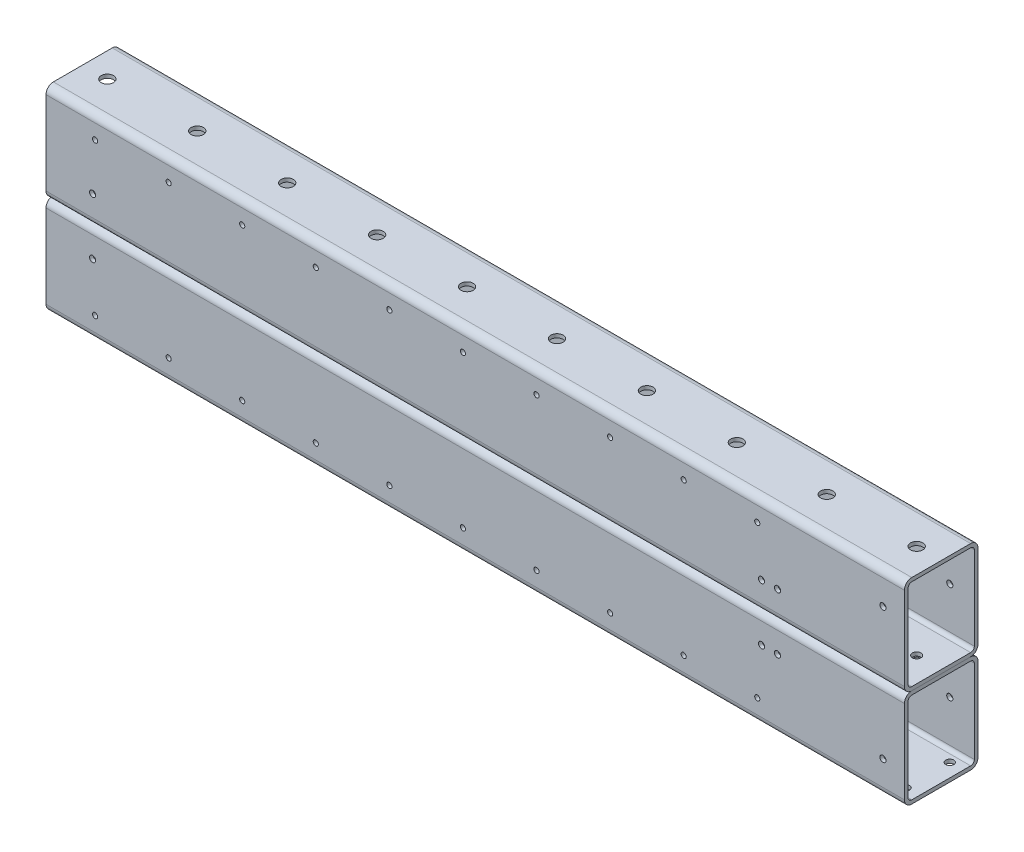
from build123d import *

# Parameters (mm, degrees)
BOSS_EXTRUDE1_DEPTH                   = 350
BOSS_EXTRUDE1_DEPTH_BACK              = 350
BOSS_EXTRUDE2_DEPTH                   = 350
BOSS_EXTRUDE2_DEPTH_BACK              = 350
SKETCH2_R                             = 5
CUT_EXTRUDE1_DEPTH                    = 3
SKETCH3_R                             = 3.5
CUT_EXTRUDE2_DEPTH                    = 3
TAP_DRILL_FOR_M6X1_0_TAP1_AT_2_COUNT  = 2
TAP_DRILL_FOR_M6X1_0_TAP1_AT_2_PITCH  = 73.33
TAP_DRILL_FOR_M6X1_0_TAP1_AT_3_COUNT  = 2
TAP_DRILL_FOR_M6X1_0_TAP1_AT_3_PITCH  = 146.66
TAP_DRILL_FOR_M6X1_0_TAP1_AT_4_COUNT  = 2
TAP_DRILL_FOR_M6X1_0_TAP1_AT_4_PITCH  = 219.99
TAP_DRILL_FOR_M6X1_0_TAP1_AT_5_COUNT  = 2
TAP_DRILL_FOR_M6X1_0_TAP1_AT_5_PITCH  = 293.32
TAP_DRILL_FOR_M6X1_0_TAP1_AT_6_COUNT  = 2
TAP_DRILL_FOR_M6X1_0_TAP1_AT_6_PITCH  = 366.65
TAP_DRILL_FOR_M6X1_0_TAP1_AT_7_COUNT  = 2
TAP_DRILL_FOR_M6X1_0_TAP1_AT_7_PITCH  = 439.98
TAP_DRILL_FOR_M6X1_0_TAP1_AT_8_COUNT  = 2
TAP_DRILL_FOR_M6X1_0_TAP1_AT_8_PITCH  = 513.31
TAP_DRILL_FOR_M6X1_0_TAP1_AT_9_COUNT  = 2
TAP_DRILL_FOR_M6X1_0_TAP1_AT_9_PITCH  = 586.64
TAP_DRILL_FOR_M6X1_0_TAP1_AT_10_COUNT = 2
TAP_DRILL_FOR_M6X1_0_TAP1_AT_10_PITCH = 659.97
TAP_DRILL_FOR_M6X1_0_TAP2_AT_2_COUNT  = 2
TAP_DRILL_FOR_M6X1_0_TAP2_AT_2_PITCH  = 40
TAP_DRILL_FOR_M6X1_0_TAP2_AT_3_COUNT  = 2
TAP_DRILL_FOR_M6X1_0_TAP2_AT_3_PITCH  = 80
TAP_DRILL_FOR_M6X1_0_TAP2_AT_4_COUNT  = 2
TAP_DRILL_FOR_M6X1_0_TAP2_AT_4_PITCH  = 89.4427191
TAP_DRILL_FOR_M5X0_8_TAP1_AT_2_COUNT  = 2
TAP_DRILL_FOR_M5X0_8_TAP1_AT_2_PITCH  = 123.96353247
LPATTERN1_COUNT                       = 10
LPATTERN1_PITCH                       = 60
TAP_DRILL_FOR_M6X1_0_TAP4_AT_2_COUNT  = 2
TAP_DRILL_FOR_M6X1_0_TAP4_AT_2_PITCH  = 107.6
F_6_5_6_5_DIAMETER_HOLE1_AT_2_COUNT   = 2
F_6_5_6_5_DIAMETER_HOLE1_AT_2_PITCH   = 36
F_6_5_6_5_DIAMETER_HOLE1_AT_3_COUNT   = 2
F_6_5_6_5_DIAMETER_HOLE1_AT_3_PITCH   = 68.264192664
F_6_5_6_5_DIAMETER_HOLE1_AT_4_COUNT   = 2
F_6_5_6_5_DIAMETER_HOLE1_AT_4_PITCH   = 58
F_6_5_6_5_DIAMETER_HOLE1_AT_5_COUNT   = 2
F_6_5_6_5_DIAMETER_HOLE1_AT_5_PITCH   = 562
F_6_5_6_5_DIAMETER_HOLE1_AT_6_COUNT   = 2
F_6_5_6_5_DIAMETER_HOLE1_AT_6_PITCH   = 563.151844532
F_6_5_6_5_DIAMETER_HOLE1_AT_7_COUNT   = 2
F_6_5_6_5_DIAMETER_HOLE1_AT_7_PITCH   = 621.044281835
F_6_5_6_5_DIAMETER_HOLE1_AT_8_COUNT   = 2
F_6_5_6_5_DIAMETER_HOLE1_AT_8_PITCH   = 620
TAP_DRILL_FOR_M6X1_0_TAP5_AT_2_COUNT  = 2
TAP_DRILL_FOR_M6X1_0_TAP5_AT_2_PITCH  = 46
TAP_DRILL_FOR_M6X1_0_TAP5_AT_3_COUNT  = 2
TAP_DRILL_FOR_M6X1_0_TAP5_AT_3_PITCH  = 545.5
TAP_DRILL_FOR_M6X1_0_TAP5_AT_4_COUNT  = 2
TAP_DRILL_FOR_M6X1_0_TAP5_AT_4_PITCH  = 558.5
TAP_DRILL_FOR_M6X1_0_TAP5_AT_5_COUNT  = 2
TAP_DRILL_FOR_M6X1_0_TAP5_AT_5_PITCH  = 560.391158032
TAP_DRILL_FOR_M6X1_0_TAP5_AT_6_COUNT  = 2
TAP_DRILL_FOR_M6X1_0_TAP5_AT_6_PITCH  = 547.436069327


with BuildPart() as part:
    # Sketch1 → Boss-Extrude1 (new, two sides: drawn at the far end of the back side and taken through both)
    with BuildSketch(Plane(origin=(0, 0, 0), x_dir=(0, 0, -1), z_dir=(1, 0, 0)).offset(-BOSS_EXTRUDE1_DEPTH_BACK)):
        with BuildLine():
            Line((-24, 0), (24, 0))
            ThreePointArc((24, 0), (28.242640687, 1.757359313), (30, 6))
            Line((30, 6), (30, 74))
            ThreePointArc((30, 74), (28.242640687, 78.242640687), (24, 80))
            Line((24, 80), (-24, 80))
            ThreePointArc((-24, 80), (-28.242640687, 78.242640687), (-30, 74))
            Line((-30, 74), (-30, 6))
            ThreePointArc((-30, 6), (-28.242640687, 1.757359313), (-24, 0))
        make_face()
        with BuildLine():
            Line((-24, 3), (24, 3))
            ThreePointArc((24, 3), (26.121320344, 3.878679656), (27, 6))
            Line((27, 6), (27, 74))
            ThreePointArc((27, 74), (26.121320344, 76.121320344), (24, 77))
            Line((24, 77), (-24, 77))
            ThreePointArc((-24, 77), (-26.121320344, 76.121320344), (-27, 74))
            Line((-27, 74), (-27, 6))
            ThreePointArc((-27, 6), (-26.121320344, 3.878679656), (-24, 3))
        make_face(mode=Mode.SUBTRACT)
    extrude(amount=BOSS_EXTRUDE1_DEPTH + BOSS_EXTRUDE1_DEPTH_BACK)

    # Sketch2 → Cut-Extrude1 (cut)
    with BuildSketch(Plane(origin=(0, 80, 0), x_dir=(1, 0, 0), z_dir=(0, 1, 0))):
        with Locations(Location((330, 0, 0), (0, 0, 270))):
            Circle(SKETCH2_R)
        with Locations(Location((256.67, 0, 0), (0, 0, 270))):
            Circle(SKETCH2_R)
        with Locations(Location((183.34, 0, 0), (0, 0, 270))):
            Circle(SKETCH2_R)
        with Locations(Location((110.01, 0, 0), (0, 0, 270))):
            Circle(SKETCH2_R)
        with Locations(Location((36.68, 0, 0), (0, 0, 270))):
            Circle(SKETCH2_R)
        with Locations(Location((-36.65, 0, 0), (0, 0, 270))):
            Circle(SKETCH2_R)
        with Locations(Location((-109.98, 0, 0), (0, 0, 270))):
            Circle(SKETCH2_R)
        with Locations(Location((-183.31, 0, 0), (0, 0, 270))):
            Circle(SKETCH2_R)
        with Locations(Location((-256.64, 0, 0), (0, 0, 270))):
            Circle(SKETCH2_R)
        with Locations(Location((-329.97, 0, 0), (0, 0, 270))):
            Circle(SKETCH2_R)
    extrude(amount=-CUT_EXTRUDE1_DEPTH, mode=Mode.SUBTRACT)

    # Sketch3 → Cut-Extrude2 (cut)
    with BuildSketch(Plane(origin=(0, 3, 0), x_dir=(1, 0, 0), z_dir=(0, 1, 0))):
        with Locations(Location((-329.97, 0, 0), (0, 0, 270))):
            Circle(SKETCH3_R)
        with Locations(Location((-256.64, 0, 0), (0, 0, 270))):
            Circle(SKETCH3_R)
        with Locations(Location((-183.31, 0, 0), (0, 0, 270))):
            Circle(SKETCH3_R)
        with Locations(Location((-109.98, 0, 0), (0, 0, 270))):
            Circle(SKETCH3_R)
        with Locations(Location((-36.65, 0, 0), (0, 0, 270))):
            Circle(SKETCH3_R)
        with Locations(Location((36.68, 0, 0), (0, 0, 270))):
            Circle(SKETCH3_R)
        with Locations(Location((110.01, 0, 0), (0, 0, 270))):
            Circle(SKETCH3_R)
        with Locations(Location((183.34, 0, 0), (0, 0, 270))):
            Circle(SKETCH3_R)
        with Locations(Location((256.67, 0, 0), (0, 0, 270))):
            Circle(SKETCH3_R)
        with Locations(Location((330, 0, 0), (0, 0, 270))):
            Circle(SKETCH3_R)
    extrude(amount=-CUT_EXTRUDE2_DEPTH, mode=Mode.SUBTRACT)

    # Sketch6 → Tap Drill for M6x1.0 Tap2 (revolve, cut)
    with BuildSketch(Plane(origin=(330, 40, -30), x_dir=(0, 1, 0), z_dir=(1, 0, 0))):
        Polygon((0, 0), (0, 4.502151548), (2.5, 3), (2.5, 0), align=None)
    tap_drill_for_m6x1_0_tap2 = revolve(axis=Axis((330, 40, -36.35), (0, 0, 1)), mode=Mode.SUBTRACT)

    # Tap Drill for M6x1.0 Tap2 at 2: Tap Drill for M6x1.0 Tap2 ×2
    with Locations(*[(-i * TAP_DRILL_FOR_M6X1_0_TAP2_AT_2_PITCH, 0, 0) for i in range(1, TAP_DRILL_FOR_M6X1_0_TAP2_AT_2_COUNT)]):
        add(tap_drill_for_m6x1_0_tap2, mode=Mode.SUBTRACT)

    # Mirror1: Tap Drill for M6x1.0 Tap2 across plane
    add(tap_drill_for_m6x1_0_tap2.mirror(Plane(origin=(0, 0, 0), x_dir=(0, 0, 1), z_dir=(1, 0, 0))), mode=Mode.SUBTRACT)

    # Mirror1 copy 1 sketch → Mirror1 copy 1 (revolve, cut)
    with BuildSketch(Plane(origin=(-290, 40, -30), x_dir=(0, 1, 0), z_dir=(-1, 0, 0))):
        Polygon((0, 0), (0, -4.502151548), (2.5, -3), (2.5, 0), align=None)
    revolve(axis=Axis((-290, 40, -36.35), (0, 0, -1)), mode=Mode.SUBTRACT)

    # Sketch10 → Tap Drill for M5x0.8 Tap1 (revolve, cut)
    with BuildSketch(Plane(origin=(-310, 61.981766235, 30), x_dir=(0, -1, 0), z_dir=(1, 0, 0))):
        Polygon((0, 0), (0, 4.2618073), (2.1, 3), (2.1, 0), align=None)
    tap_drill_for_m5x0_8_tap1 = revolve(axis=Axis((-310, 61.981766235, 36.35), (0, 0, -1)), mode=Mode.SUBTRACT)

    # LPattern1: Tap Drill for M5x0.8 Tap1 ×10
    with Locations(*[(i * LPATTERN1_PITCH, 0, 0) for i in range(1, LPATTERN1_COUNT)]):
        add(tap_drill_for_m5x0_8_tap1, mode=Mode.SUBTRACT)


with BuildPart() as body_2:
    # Sketch1<3> → Boss-Extrude2 (new, two sides: drawn at the far end of the back side and taken through both)
    with BuildSketch(Plane(origin=(0, 0, 0), x_dir=(0, 0, -1), z_dir=(1, 0, 0)).offset(-BOSS_EXTRUDE2_DEPTH_BACK)):
        with BuildLine():
            ThreePointArc((-30, -6), (-28.242640687, -1.757359313), (-24, 0))
            Line((-24, 0), (24, 0))
            ThreePointArc((24, 0), (28.242640687, -1.757359313), (30, -6))
            Line((30, -6), (30, -74))
            ThreePointArc((30, -74), (28.242640687, -78.242640687), (24, -80))
            Line((24, -80), (-24, -80))
            ThreePointArc((-24, -80), (-28.242640687, -78.242640687), (-30, -74))
            Line((-30, -74), (-30, -6))
        make_face()
        with BuildLine():
            Line((-24, -77), (24, -77))
            ThreePointArc((24, -77), (26.121320344, -76.121320344), (27, -74))
            Line((27, -74), (27, -6))
            ThreePointArc((27, -6), (26.121320344, -3.878679656), (24, -3))
            Line((24, -3), (-24, -3))
            ThreePointArc((-24, -3), (-26.121320344, -3.878679656), (-27, -6))
            Line((-27, -6), (-27, -74))
            ThreePointArc((-27, -74), (-26.121320344, -76.121320344), (-24, -77))
        make_face(mode=Mode.SUBTRACT)
    extrude(amount=BOSS_EXTRUDE2_DEPTH + BOSS_EXTRUDE2_DEPTH_BACK)

    # Sketch4 → Tap Drill for M6x1.0 Tap1 (revolve, cut)
    with BuildSketch(Plane(origin=(-329.97, 3, 0), x_dir=(0, 0, 1), z_dir=(1, 0, 0))):
        Polygon((0, 0), (0, 7.502151548), (2.5, 6), (2.5, 0), align=None)
    tap_drill_for_m6x1_0_tap1 = revolve(axis=Axis((-329.97, 9.35, 0), (0, -1, 0)), mode=Mode.SUBTRACT)

    # Tap Drill for M6x1.0 Tap1 at 2: Tap Drill for M6x1.0 Tap1 ×2
    with Locations(*[(i * TAP_DRILL_FOR_M6X1_0_TAP1_AT_2_PITCH, 0, 0) for i in range(1, TAP_DRILL_FOR_M6X1_0_TAP1_AT_2_COUNT)]):
        add(tap_drill_for_m6x1_0_tap1, mode=Mode.SUBTRACT)

    # Tap Drill for M6x1.0 Tap1 at 3: Tap Drill for M6x1.0 Tap1 ×2
    with Locations(*[(i * TAP_DRILL_FOR_M6X1_0_TAP1_AT_3_PITCH, 0, 0) for i in range(1, TAP_DRILL_FOR_M6X1_0_TAP1_AT_3_COUNT)]):
        add(tap_drill_for_m6x1_0_tap1, mode=Mode.SUBTRACT)

    # Tap Drill for M6x1.0 Tap1 at 4: Tap Drill for M6x1.0 Tap1 ×2
    with Locations(*[(i * TAP_DRILL_FOR_M6X1_0_TAP1_AT_4_PITCH, 0, 0) for i in range(1, TAP_DRILL_FOR_M6X1_0_TAP1_AT_4_COUNT)]):
        add(tap_drill_for_m6x1_0_tap1, mode=Mode.SUBTRACT)

    # Tap Drill for M6x1.0 Tap1 at 5: Tap Drill for M6x1.0 Tap1 ×2
    with Locations(*[(i * TAP_DRILL_FOR_M6X1_0_TAP1_AT_5_PITCH, 0, 0) for i in range(1, TAP_DRILL_FOR_M6X1_0_TAP1_AT_5_COUNT)]):
        add(tap_drill_for_m6x1_0_tap1, mode=Mode.SUBTRACT)

    # Tap Drill for M6x1.0 Tap1 at 6: Tap Drill for M6x1.0 Tap1 ×2
    with Locations(*[(i * TAP_DRILL_FOR_M6X1_0_TAP1_AT_6_PITCH, 0, 0) for i in range(1, TAP_DRILL_FOR_M6X1_0_TAP1_AT_6_COUNT)]):
        add(tap_drill_for_m6x1_0_tap1, mode=Mode.SUBTRACT)

    # Tap Drill for M6x1.0 Tap1 at 7: Tap Drill for M6x1.0 Tap1 ×2
    with Locations(*[(i * TAP_DRILL_FOR_M6X1_0_TAP1_AT_7_PITCH, 0, 0) for i in range(1, TAP_DRILL_FOR_M6X1_0_TAP1_AT_7_COUNT)]):
        add(tap_drill_for_m6x1_0_tap1, mode=Mode.SUBTRACT)

    # Tap Drill for M6x1.0 Tap1 at 8: Tap Drill for M6x1.0 Tap1 ×2
    with Locations(*[(i * TAP_DRILL_FOR_M6X1_0_TAP1_AT_8_PITCH, 0, 0) for i in range(1, TAP_DRILL_FOR_M6X1_0_TAP1_AT_8_COUNT)]):
        add(tap_drill_for_m6x1_0_tap1, mode=Mode.SUBTRACT)

    # Tap Drill for M6x1.0 Tap1 at 9: Tap Drill for M6x1.0 Tap1 ×2
    with Locations(*[(i * TAP_DRILL_FOR_M6X1_0_TAP1_AT_9_PITCH, 0, 0) for i in range(1, TAP_DRILL_FOR_M6X1_0_TAP1_AT_9_COUNT)]):
        add(tap_drill_for_m6x1_0_tap1, mode=Mode.SUBTRACT)

    # Tap Drill for M6x1.0 Tap1 at 10: Tap Drill for M6x1.0 Tap1 ×2
    with Locations(*[(i * TAP_DRILL_FOR_M6X1_0_TAP1_AT_10_PITCH, 0, 0) for i in range(1, TAP_DRILL_FOR_M6X1_0_TAP1_AT_10_COUNT)]):
        add(tap_drill_for_m6x1_0_tap1, mode=Mode.SUBTRACT)

    # Tap Drill for M6x1.0 Tap2 at 3: Tap Drill for M6x1.0 Tap2 ×2
    with Locations(*[(0, -i * TAP_DRILL_FOR_M6X1_0_TAP2_AT_3_PITCH, 0) for i in range(1, TAP_DRILL_FOR_M6X1_0_TAP2_AT_3_COUNT)]):
        add(tap_drill_for_m6x1_0_tap2, mode=Mode.SUBTRACT)

    # Tap Drill for M6x1.0 Tap2 at 4: Tap Drill for M6x1.0 Tap2 ×2
    with Locations(*[Vector(-0.4472135954999575, -0.8944271909999161, 0) * (i * TAP_DRILL_FOR_M6X1_0_TAP2_AT_4_PITCH) for i in range(1, TAP_DRILL_FOR_M6X1_0_TAP2_AT_4_COUNT)]):
        add(tap_drill_for_m6x1_0_tap2, mode=Mode.SUBTRACT)

    # Mirror1 copy 2 sketch → Mirror1 copy 2 (revolve, cut)
    with BuildSketch(Plane(origin=(-330, -40, -30), x_dir=(0, 1, 0), z_dir=(-1, 0, 0))):
        Polygon((0, 0), (0, -4.502151548), (2.5, -3), (2.5, 0), align=None)
    revolve(axis=Axis((-330, -40, -36.35), (0, 0, -1)), mode=Mode.SUBTRACT)

    # Mirror1 copy 3 sketch → Mirror1 copy 3 (revolve, cut)
    with BuildSketch(Plane(origin=(-290, -40, -30), x_dir=(0, 1, 0), z_dir=(-1, 0, 0))):
        Polygon((0, 0), (0, -4.502151548), (2.5, -3), (2.5, 0), align=None)
    revolve(axis=Axis((-290, -40, -36.35), (0, 0, -1)), mode=Mode.SUBTRACT)

    # Tap Drill for M5x0.8 Tap1 at 2: Tap Drill for M5x0.8 Tap1 ×2
    with Locations(*[(0, -i * TAP_DRILL_FOR_M5X0_8_TAP1_AT_2_PITCH, 0) for i in range(1, TAP_DRILL_FOR_M5X0_8_TAP1_AT_2_COUNT)]):
        add(tap_drill_for_m5x0_8_tap1, mode=Mode.SUBTRACT)

    # LPattern1 copy 1 sketch → LPattern1 copy 1 (revolve, cut)
    with BuildSketch(Plane(origin=(-250, -61.981766235, 30), x_dir=(0, -1, 0), z_dir=(1, 0, 0))):
        Polygon((0, 0), (0, 4.2618073), (2.1, 3), (2.1, 0), align=None)
    revolve(axis=Axis((-250, -61.981766235, 36.35), (0, 0, -1)), mode=Mode.SUBTRACT)

    # LPattern1 copy 2 sketch → LPattern1 copy 2 (revolve, cut)
    with BuildSketch(Plane(origin=(-190, -61.981766235, 30), x_dir=(0, -1, 0), z_dir=(1, 0, 0))):
        Polygon((0, 0), (0, 4.2618073), (2.1, 3), (2.1, 0), align=None)
    revolve(axis=Axis((-190, -61.981766235, 36.35), (0, 0, -1)), mode=Mode.SUBTRACT)

    # LPattern1 copy 3 sketch → LPattern1 copy 3 (revolve, cut)
    with BuildSketch(Plane(origin=(-130, -61.981766235, 30), x_dir=(0, -1, 0), z_dir=(1, 0, 0))):
        Polygon((0, 0), (0, 4.2618073), (2.1, 3), (2.1, 0), align=None)
    revolve(axis=Axis((-130, -61.981766235, 36.35), (0, 0, -1)), mode=Mode.SUBTRACT)

    # LPattern1 copy 4 sketch → LPattern1 copy 4 (revolve, cut)
    with BuildSketch(Plane(origin=(-70, -61.981766235, 30), x_dir=(0, -1, 0), z_dir=(1, 0, 0))):
        Polygon((0, 0), (0, 4.2618073), (2.1, 3), (2.1, 0), align=None)
    revolve(axis=Axis((-70, -61.981766235, 36.35), (0, 0, -1)), mode=Mode.SUBTRACT)

    # LPattern1 copy 5 sketch → LPattern1 copy 5 (revolve, cut)
    with BuildSketch(Plane(origin=(-10, -61.981766235, 30), x_dir=(0, -1, 0), z_dir=(1, 0, 0))):
        Polygon((0, 0), (0, 4.2618073), (2.1, 3), (2.1, 0), align=None)
    revolve(axis=Axis((-10, -61.981766235, 36.35), (0, 0, -1)), mode=Mode.SUBTRACT)

    # LPattern1 copy 6 sketch → LPattern1 copy 6 (revolve, cut)
    with BuildSketch(Plane(origin=(50, -61.981766235, 30), x_dir=(0, -1, 0), z_dir=(1, 0, 0))):
        Polygon((0, 0), (0, 4.2618073), (2.1, 3), (2.1, 0), align=None)
    revolve(axis=Axis((50, -61.981766235, 36.35), (0, 0, -1)), mode=Mode.SUBTRACT)

    # LPattern1 copy 7 sketch → LPattern1 copy 7 (revolve, cut)
    with BuildSketch(Plane(origin=(110, -61.981766235, 30), x_dir=(0, -1, 0), z_dir=(1, 0, 0))):
        Polygon((0, 0), (0, 4.2618073), (2.1, 3), (2.1, 0), align=None)
    revolve(axis=Axis((110, -61.981766235, 36.35), (0, 0, -1)), mode=Mode.SUBTRACT)

    # LPattern1 copy 8 sketch → LPattern1 copy 8 (revolve, cut)
    with BuildSketch(Plane(origin=(170, -61.981766235, 30), x_dir=(0, -1, 0), z_dir=(1, 0, 0))):
        Polygon((0, 0), (0, 4.2618073), (2.1, 3), (2.1, 0), align=None)
    revolve(axis=Axis((170, -61.981766235, 36.35), (0, 0, -1)), mode=Mode.SUBTRACT)

    # LPattern1 copy 9 sketch → LPattern1 copy 9 (revolve, cut)
    with BuildSketch(Plane(origin=(230, -61.981766235, 30), x_dir=(0, -1, 0), z_dir=(1, 0, 0))):
        Polygon((0, 0), (0, 4.2618073), (2.1, 3), (2.1, 0), align=None)
    revolve(axis=Axis((230, -61.981766235, 36.35), (0, 0, -1)), mode=Mode.SUBTRACT)

    # Sketch13 → Tap Drill for M6x1.0 Tap4 (revolve, cut)
    with BuildSketch(Plane(origin=(332.5, -53.8, 30), x_dir=(0, -1, 0), z_dir=(1, 0, 0))):
        Polygon((0, 0), (0, 4.502151548), (2.5, 3), (2.5, 0), align=None)
    tap_drill_for_m6x1_0_tap4 = revolve(axis=Axis((332.5, -53.8, 36.35), (0, 0, -1)), mode=Mode.SUBTRACT)

    # Sketch15 → Ø6.5 (6.5) Diameter Hole1 (revolve, cut)
    with BuildSketch(Plane(origin=(-281, -80, 18), x_dir=(0, 0, -1), z_dir=(1, 0, 0))):
        Polygon((0, 0), (0, 4.952797012), (3.25, 3), (3.25, 0), align=None)
    f_6_5_6_5_diameter_hole1 = revolve(axis=Axis((-281, -86.35, 18), (0, 1, 0)), mode=Mode.SUBTRACT)

    # Ø6.5 (6.5) Diameter Hole1 at 2: Ø6.5 (6.5) Diameter Hole1 ×2
    with Locations(*[(0, 0, -i * F_6_5_6_5_DIAMETER_HOLE1_AT_2_PITCH) for i in range(1, F_6_5_6_5_DIAMETER_HOLE1_AT_2_COUNT)]):
        add(f_6_5_6_5_diameter_hole1, mode=Mode.SUBTRACT)

    # Ø6.5 (6.5) Diameter Hole1 at 3: Ø6.5 (6.5) Diameter Hole1 ×2
    with Locations(*[Vector(-0.8496401661981189, 0, -0.5273628617781433) * (i * F_6_5_6_5_DIAMETER_HOLE1_AT_3_PITCH) for i in range(1, F_6_5_6_5_DIAMETER_HOLE1_AT_3_COUNT)]):
        add(f_6_5_6_5_diameter_hole1, mode=Mode.SUBTRACT)

    # Ø6.5 (6.5) Diameter Hole1 at 4: Ø6.5 (6.5) Diameter Hole1 ×2
    with Locations(*[(-i * F_6_5_6_5_DIAMETER_HOLE1_AT_4_PITCH, 0, 0) for i in range(1, F_6_5_6_5_DIAMETER_HOLE1_AT_4_COUNT)]):
        add(f_6_5_6_5_diameter_hole1, mode=Mode.SUBTRACT)

    # Ø6.5 (6.5) Diameter Hole1 at 5: Ø6.5 (6.5) Diameter Hole1 ×2
    with Locations(*[(i * F_6_5_6_5_DIAMETER_HOLE1_AT_5_PITCH, 0, 0) for i in range(1, F_6_5_6_5_DIAMETER_HOLE1_AT_5_COUNT)]):
        add(f_6_5_6_5_diameter_hole1, mode=Mode.SUBTRACT)

    # Ø6.5 (6.5) Diameter Hole1 at 6: Ø6.5 (6.5) Diameter Hole1 ×2
    with Locations(*[Vector(0.9979546466137569, 0, -0.06392592042365702) * (i * F_6_5_6_5_DIAMETER_HOLE1_AT_6_PITCH) for i in range(1, F_6_5_6_5_DIAMETER_HOLE1_AT_6_COUNT)]):
        add(f_6_5_6_5_diameter_hole1, mode=Mode.SUBTRACT)

    # Ø6.5 (6.5) Diameter Hole1 at 7: Ø6.5 (6.5) Diameter Hole1 ×2
    with Locations(*[Vector(0.9983185066418229, 0, -0.05796688103081552) * (i * F_6_5_6_5_DIAMETER_HOLE1_AT_7_PITCH) for i in range(1, F_6_5_6_5_DIAMETER_HOLE1_AT_7_COUNT)]):
        add(f_6_5_6_5_diameter_hole1, mode=Mode.SUBTRACT)

    # Ø6.5 (6.5) Diameter Hole1 at 8: Ø6.5 (6.5) Diameter Hole1 ×2
    with Locations(*[(i * F_6_5_6_5_DIAMETER_HOLE1_AT_8_PITCH, 0, 0) for i in range(1, F_6_5_6_5_DIAMETER_HOLE1_AT_8_COUNT)]):
        add(f_6_5_6_5_diameter_hole1, mode=Mode.SUBTRACT)


with BuildPart() as part_1:
    add(part.part)

    # Tap Drill for M6x1.0 Tap4 at 2: Tap Drill for M6x1.0 Tap4 ×2
    with Locations(*[(0, i * TAP_DRILL_FOR_M6X1_0_TAP4_AT_2_PITCH, 0) for i in range(1, TAP_DRILL_FOR_M6X1_0_TAP4_AT_2_COUNT)]):
        add(tap_drill_for_m6x1_0_tap4, mode=Mode.SUBTRACT)

    # Sketch18 → Tap Drill for M6x1.0 Tap5 (revolve, cut)
    with BuildSketch(Plane(origin=(-312, 23, 30), x_dir=(0, -1, 0), z_dir=(1, 0, 0))):
        Polygon((0, 0), (0, 4.502151548), (2.5, 3), (2.5, 0), align=None)
    tap_drill_for_m6x1_0_tap5 = revolve(axis=Axis((-312, 23, 36.35), (0, 0, -1)), mode=Mode.SUBTRACT)

    # Tap Drill for M6x1.0 Tap5 at 3: Tap Drill for M6x1.0 Tap5 ×2
    with Locations(*[(i * TAP_DRILL_FOR_M6X1_0_TAP5_AT_3_PITCH, 0, 0) for i in range(1, TAP_DRILL_FOR_M6X1_0_TAP5_AT_3_COUNT)]):
        add(tap_drill_for_m6x1_0_tap5, mode=Mode.SUBTRACT)

    # Tap Drill for M6x1.0 Tap5 at 4: Tap Drill for M6x1.0 Tap5 ×2
    with Locations(*[(i * TAP_DRILL_FOR_M6X1_0_TAP5_AT_4_PITCH, 0, 0) for i in range(1, TAP_DRILL_FOR_M6X1_0_TAP5_AT_4_COUNT)]):
        add(tap_drill_for_m6x1_0_tap5, mode=Mode.SUBTRACT)


with BuildPart() as body_2_1:
    add(body_2.part)

    # Tap Drill for M6x1.0 Tap5 at 2: Tap Drill for M6x1.0 Tap5 ×2
    with Locations(*[(0, -i * TAP_DRILL_FOR_M6X1_0_TAP5_AT_2_PITCH, 0) for i in range(1, TAP_DRILL_FOR_M6X1_0_TAP5_AT_2_COUNT)]):
        add(tap_drill_for_m6x1_0_tap5, mode=Mode.SUBTRACT)

    # Tap Drill for M6x1.0 Tap5 at 5: Tap Drill for M6x1.0 Tap5 ×2
    with Locations(*[Vector(0.9966252893099775, -0.08208552069520962, 0) * (i * TAP_DRILL_FOR_M6X1_0_TAP5_AT_5_PITCH) for i in range(1, TAP_DRILL_FOR_M6X1_0_TAP5_AT_5_COUNT)]):
        add(tap_drill_for_m6x1_0_tap5, mode=Mode.SUBTRACT)

    # Tap Drill for M6x1.0 Tap5 at 6: Tap Drill for M6x1.0 Tap5 ×2
    with Locations(*[Vector(0.9964633873518727, -0.08402807666031484, 0) * (i * TAP_DRILL_FOR_M6X1_0_TAP5_AT_6_PITCH) for i in range(1, TAP_DRILL_FOR_M6X1_0_TAP5_AT_6_COUNT)]):
        add(tap_drill_for_m6x1_0_tap5, mode=Mode.SUBTRACT)


solid = Compound([part_1.part, body_2_1.part])
